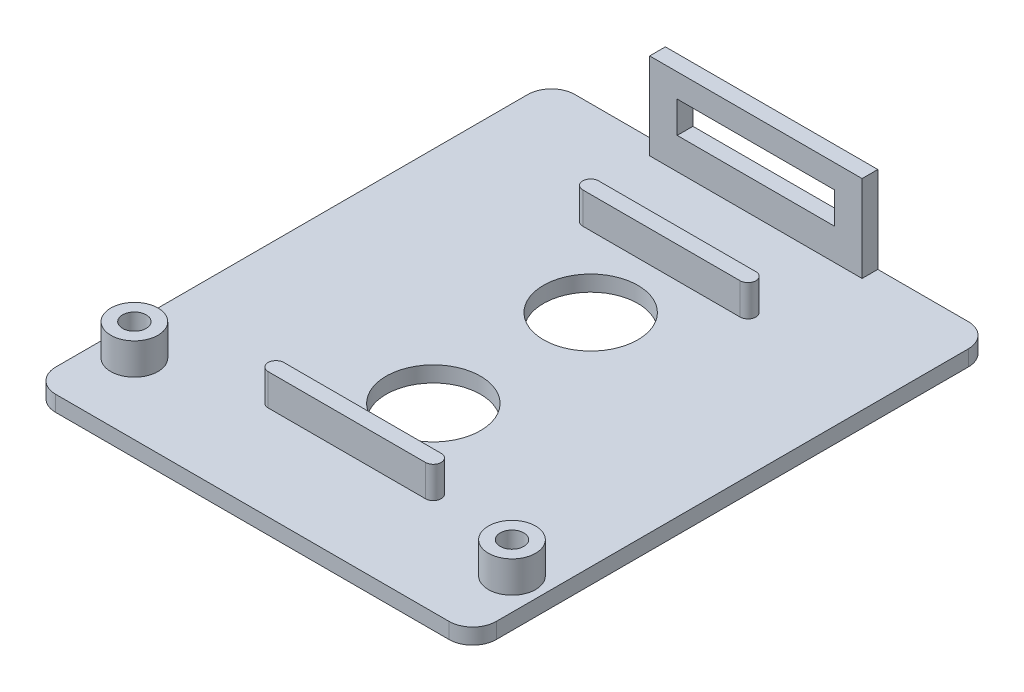
from build123d import *

# Parameters (mm, degrees)
BASE_4_R              = 1.5
BASE_4_R_2            = 0.75
BOSS_EXTRUDE5_DEPTH   = 3
BOSS_EXTRUDE5_2_DEPTH = 3
BASE_W                = 13.5
BASE_H                = 1
BOSS_EXTRUDE7_DEPTH   = 6.5
BASE_7_R              = 1.5
BASE_7_R_2            = 3
BOSS_EXTRUDE8_DEPTH   = 1
BOSS_EXTRUDE9_DEPTH   = 3
SLIT_W                = 10
SLIT_H                = 2
CUT_EXTRUDE2_DEPTH    = 6.5


with BuildPart() as part:
    # Base<4> → Boss-Extrude5 (new body)
    with BuildSketch(Plane(origin=(0, 0, 0), x_dir=(1, 0, 0), z_dir=(0, 1, 0))):
        with Locations((-12, -12)):
            Circle(BASE_4_R)
        with Locations((-12, -12)):
            Circle(BASE_4_R_2, mode=Mode.SUBTRACT)
    extrude(amount=BOSS_EXTRUDE5_DEPTH)



with BuildPart() as body_2:
    # Base<4> → Boss-Extrude5 2 (new body)
    with BuildSketch(Plane(origin=(0, 0, 0), x_dir=(1, 0, 0), z_dir=(0, 1, 0))):
        with Locations((12, -12)):
            Circle(BASE_4_R)
        with Locations((12, -12)):
            Circle(BASE_4_R_2, mode=Mode.SUBTRACT)
    extrude(amount=BOSS_EXTRUDE5_2_DEPTH)


with BuildPart() as body_3:
    # Base → Boss-Extrude7 (new body)
    with BuildSketch(Plane(origin=(0, 0, 0), x_dir=(1, 0, 0), z_dir=(0, 1, 0))):
        with Locations((0, 16)):
            Rectangle(BASE_W, BASE_H)
    extrude(amount=BOSS_EXTRUDE7_DEPTH)


with BuildPart() as part_1:
    add(part.part)

    add(body_2.part)  # Boss-Extrude8 merges body 2

    add(body_3.part)  # Boss-Extrude8 merges body 3
    # Base<7> → Boss-Extrude8 (add)
    with BuildSketch(Plane(origin=(0, 0, 0), x_dir=(1, 0, 0), z_dir=(0, 1, 0))):
        with BuildLine():
            ThreePointArc((14, 15), (13.560660172, 16.060660172), (12.5, 16.5))
            Line((12.5, 16.5), (6.75, 16.5))
            Line((6.75, 16.5), (6.75, 15.5))
            Line((6.75, 15.5), (-6.75, 15.5))
            Line((-6.75, 15.5), (-6.75, 16.5))
            Line((-6.75, 16.5), (-12.5, 16.5))
            ThreePointArc((-12.5, 16.5), (-13.560660172, 16.060660172), (-14, 15))
            Line((-14, 15), (-14, -15))
            ThreePointArc((-14, -15), (-13.560660172, -16.060660172), (-12.5, -16.5))
            Line((-12.5, -16.5), (12.5, -16.5))
            ThreePointArc((12.5, -16.5), (13.560660172, -16.060660172), (14, -15))
            Line((14, -15), (14, 15))
        make_face()
        with Locations((-12, -12)):
            Circle(BASE_7_R, mode=Mode.SUBTRACT)
        with Locations((0, -5)):
            Circle(BASE_7_R_2, mode=Mode.SUBTRACT)
        with Locations((12, -12)):
            Circle(BASE_7_R, mode=Mode.SUBTRACT)
        with Locations((0, 5)):
            Circle(BASE_7_R_2, mode=Mode.SUBTRACT)
    extrude(amount=BOSS_EXTRUDE8_DEPTH)

    # Base<8> → Boss-Extrude9 (add)
    with BuildSketch(Plane(origin=(0, 0, 0), x_dir=(1, 0, 0), z_dir=(0, 1, 0))):
        with BuildLine():
            Line((-5, -9.5), (5, -9.5))
            ThreePointArc((5, -9.5), (5.5, -10), (5, -10.5))
            Line((5, -10.5), (-5, -10.5))
            ThreePointArc((-5, -10.5), (-5.5, -10), (-5, -9.5))
        make_face()
        with BuildLine():
            Line((-5, 10.5), (5, 10.5))
            ThreePointArc((5, 10.5), (5.5, 10), (5, 9.5))
            Line((5, 9.5), (-5, 9.5))
            ThreePointArc((-5, 9.5), (-5.5, 10), (-5, 10.5))
        make_face()
    extrude(amount=BOSS_EXTRUDE9_DEPTH)

    # slit → Cut-Extrude2 (cut)
    with BuildSketch(Plane.XY.offset(-15.5)):
        with Locations((0, 4)):
            Rectangle(SLIT_W, SLIT_H)
    extrude(amount=-CUT_EXTRUDE2_DEPTH, mode=Mode.SUBTRACT)


solid = part_1.part
